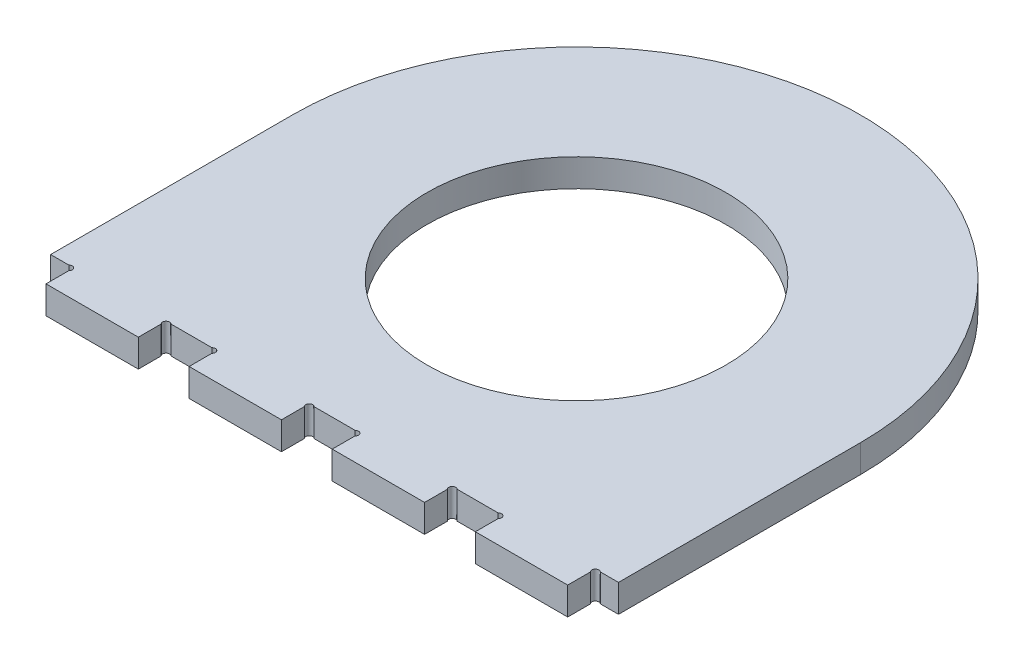
from build123d import *

# Parameters (mm, degrees)
CROQUIS1_R              = 64.75
SALIENTE_EXTRUIR2_DEPTH = 12


with BuildPart() as part:
    # Croquis1 → Saliente-Extruir2 (new body)
    with BuildSketch(Plane(origin=(0, 0, 0), x_dir=(1, 0, 0), z_dir=(0, 1, 0))):
        with BuildLine():
            Line((57, 0), (57, 104.820295074))
            ThreePointArc((57, 104.820295074), (180, 227.820295074), (303, 104.820295074))
            Line((303, 104.820295074), (303, 0))
            Line((303, 0), (295.121320344, 0))
            ThreePointArc((295.121320344, 0), (293, 0), (293, -2.121320344))
            Line((293, -2.121320344), (293, -12))
            Line((293, -12), (253, -12))
            Line((253, -12), (253, -2.121320344))
            ThreePointArc((253, -2.121320344), (253, 0), (250.878679656, 0))
            Line((250.878679656, 0), (233.121320344, 0))
            ThreePointArc((233.121320344, 0), (231, 0), (231, -2.121320344))
            Line((231, -2.121320344), (231, -12))
            Line((231, -12), (191, -12))
            Line((191, -12), (191, -2.121320344))
            ThreePointArc((191, -2.121320344), (191, 0), (188.878679656, 0))
            Line((188.878679656, 0), (171.121320344, 0))
            ThreePointArc((171.121320344, 0), (169, 0), (169, -2.121320344))
            Line((169, -2.121320344), (169, -12))
            Line((169, -12), (129, -12))
            Line((129, -12), (129, -2.121320344))
            ThreePointArc((129, -2.121320344), (129, 0), (126.878679656, 0))
            Line((126.878679656, 0), (109.121320344, 0))
            ThreePointArc((109.121320344, 0), (107, 0), (107, -2.121320344))
            Line((107, -2.121320344), (107, -12))
            Line((107, -12), (67, -12))
            Line((67, -12), (67, -2.121320344))
            ThreePointArc((67, -2.121320344), (67, 0), (64.878679656, 0))
            Line((64.878679656, 0), (57, 0))
        make_face()
        with Locations(Location((180, 104.820295074, 0), (0, 0, 270))):
            Circle(CROQUIS1_R, mode=Mode.SUBTRACT)
    extrude(amount=SALIENTE_EXTRUIR2_DEPTH)


solid = part.part
